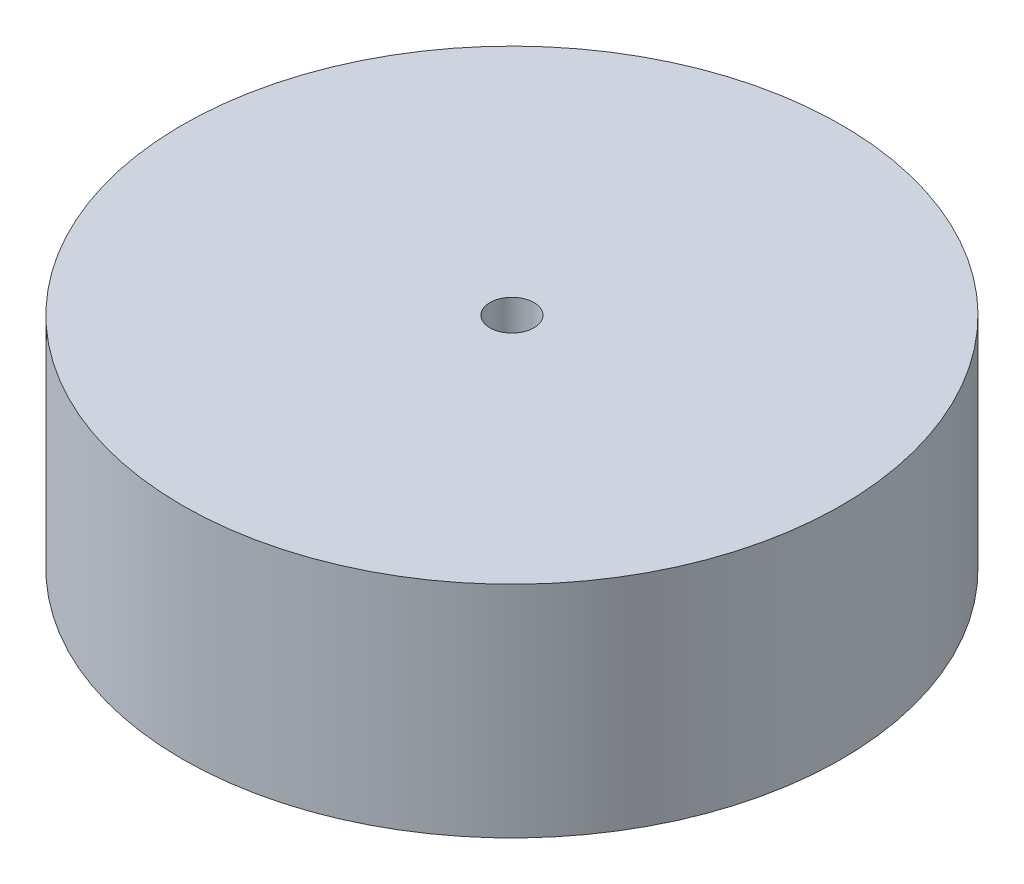
from build123d import *

# Parameters (mm, degrees)
SKETCH_1_R      = 15
SKETCH_1_R_2    = 1
EXTRUDE_1_DEPTH = 10


with BuildPart() as part:
    # 草圖1 → 填料-伸長1 (new body)
    with BuildSketch(Plane(origin=(0, 0, 0), x_dir=(1, 0, 0), z_dir=(0, 1, 0))):
        with Locations(Location((0, 0, 0), (0, 0, 270))):
            Circle(SKETCH_1_R)
        with Locations(Location((0, 0, 0), (0, 0, 270))):
            Circle(SKETCH_1_R_2, mode=Mode.SUBTRACT)
    extrude(amount=EXTRUDE_1_DEPTH)


solid = part.part
